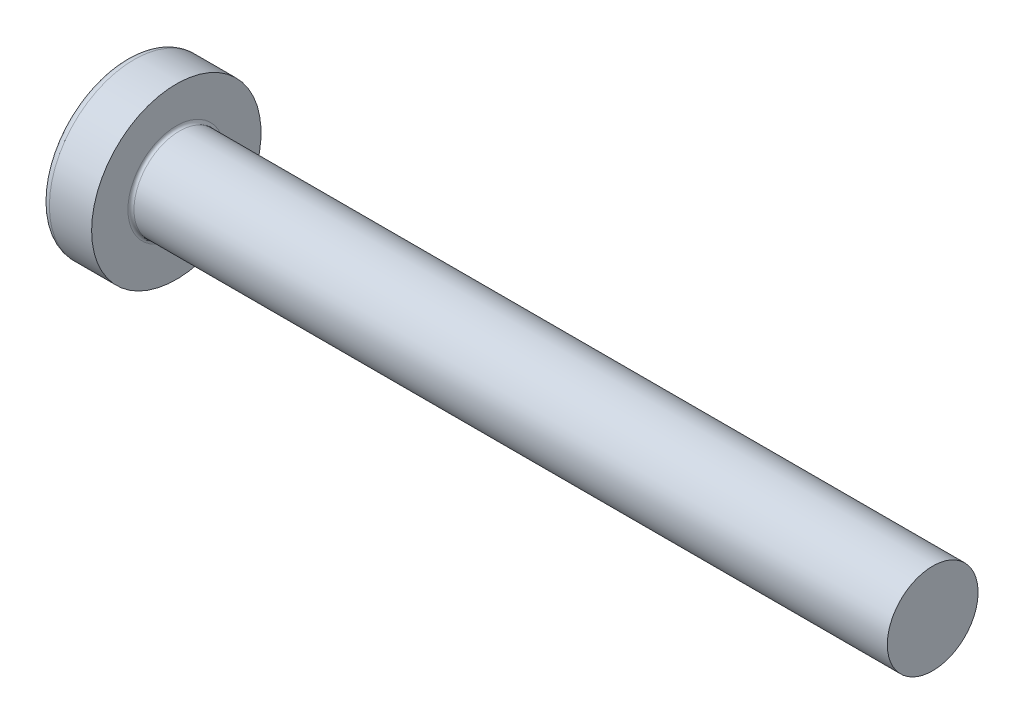
from build123d import *

# Parameters (mm, degrees)
FILLET1_R    = 0.1
RECPAT_COUNT = 2
RECPAT_ANGLE = 90


with BuildPart() as part:
    # BodySke → Base-Revolve (revolve)
    with BuildSketch(Plane.XY, mode=Mode.PRIVATE) as base_revolve_sk:
        with BuildLine():
            Line((2.4, 1.5), (2.4, 2.8))
            Line((2.4, 2.8), (1.003501533, 2.8))
            ThreePointArc((1.003501533, 2.8), (0.873295971, 2.76653015), (0.775371599, 2.674418605))
            ThreePointArc((0.775371599, 2.674418605), (0.197753546, 1.392274756), (0, 0))
            Line((0, 0), (27.4, 0))
            Line((27.4, 0), (27.4, 1.5))
            Line((27.4, 1.5), (2.4, 1.5))
        make_face()
    revolve(base_revolve_sk.sketch.rotate(Axis((1.003501533, 0, 0), (1, 0, 0)), 90), axis=Axis((1.003501533, 0, 0), (1, 0, 0)))

    # Fillet1
    fillet1_edges = [part.edges().sort_by_distance(p)[0] for p in [
        (2.4, 0, -1.5),
    ]]
    fillet(fillet1_edges, radius=FILLET1_R)

    # Sketch3 → Recess section 0
    with BuildSketch(Plane(origin=(0, 0, 0), x_dir=(0, 0, -1), z_dir=(1, 0, 0))):
        with BuildLine():
            Line((0.37, -1.4), (-0.37, -1.4))
            Line((-0.37, -1.4), (-0.37, 1.4))
            Line((-0.37, 1.4), (0.37, 1.4))
            Line((0.37, 1.4), (0.37, -1.4))
        make_face()
    # Sketch4 → Recess section 1
    with BuildSketch(Plane(origin=(1.75, 0, 0), x_dir=(0, 0, -1), z_dir=(1, 0, 0))):
        with BuildLine():
            Line((0.37, -0.527482332), (-0.37, -0.527482332))
            Line((-0.37, -0.527482332), (-0.37, 0.527482332))
            Line((-0.37, 0.527482332), (0.37, 0.527482332))
            Line((0.37, 0.527482332), (0.37, -0.527482332))
        make_face()
    recess = loft(mode=Mode.SUBTRACT)

    # RecPat: Recess ×2 about axis
    recpat_axis = Axis((0, 0, 0), (1, 0, 0))
    for i in range(1, RECPAT_COUNT):
        add(recess.rotate(recpat_axis, i * RECPAT_ANGLE / (RECPAT_COUNT - 1)), mode=Mode.SUBTRACT)

    # RecCorSke → RecessCore (revolve, cut)
    with BuildSketch(Plane.XY, mode=Mode.PRIVATE) as recesscore_sk:
        Polygon((0, 0), (0, 0.678371921), (1.75, 0.556), (1.930655351, 0), align=None)
    revolve(recesscore_sk.sketch.rotate(Axis((-3.175, 0, 0), (1, 0, 0)), 15.814025638), axis=Axis((-3.175, 0, 0), (1, 0, 0)), mode=Mode.SUBTRACT)


solid = part.part
